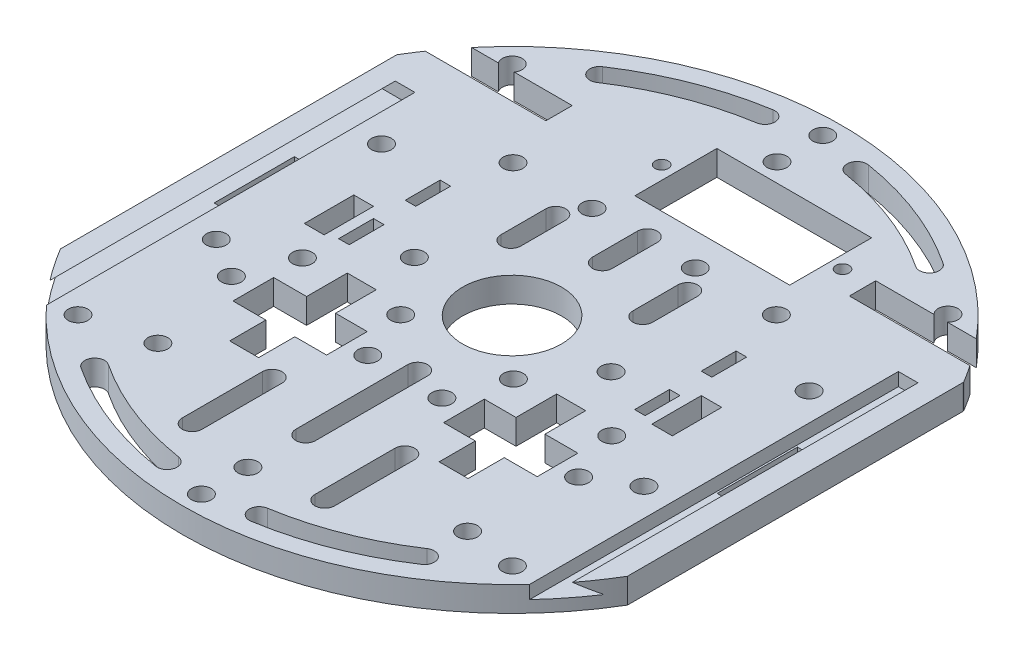
from build123d import *

# Parameters (mm, degrees)
ESQUISSE1_R             = 1.5
ESQUISSE1_W             = 1.6
ESQUISSE1_H             = 5.3
ESQUISSE1_W_2           = 2.5
ESQUISSE1_H_2           = 12.187925894
ESQUISSE1_W_3           = 3
ESQUISSE1_H_3           = 7.5
ESQUISSE1_R_2           = 1
ESQUISSE1_R_3           = 7.5
ESQUISSE1_W_4           = 3.09879963
ESQUISSE1_W_5           = 2.408451493
ESQUISSE1_W_6           = 23.501125708
ESQUISSE1_H_4           = 12.442637558
BOSS_EXTRU_1_DEPTH      = 3.8
ESQUISSE2_W             = 18.3
ESQUISSE2_H             = 4
ENL_V_MAT_EXTRU_1_DEPTH = 10
ENL_V_START             = -6.21
ENL_V_MAT_EXTRU_3_DEPTH = 65.74


with BuildPart() as part:
    # Esquisse1 → Boss.-Extru.1 (new body)
    with BuildSketch(Plane(origin=(0, 0, 0), x_dir=(1, 0, 0), z_dir=(0, 1, 0))):
        with BuildLine():
            Line((35.834434648, 167.520022271), (35.834434648, 116.483137771))
            ThreePointArc((35.834434648, 116.483137771), (78.874434648, 91.965268258), (121.914434648, 116.483137771))
            Line((121.914434648, 116.483137771), (121.914434648, 116.551281317))
            Line((121.914434648, 116.551281317), (121.914434648, 167.451878725))
            ThreePointArc((121.914434648, 167.451878725), (121.905555919, 167.517672727), (121.879554918, 167.578759801))
            ThreePointArc((121.879554918, 167.578759801), (78.840278049, 192.037880126), (35.834434648, 167.520022271))
        make_face()
        with Locations(Location((45.826639299, 109.150380711, 0), (0, 0, 90))):
            Circle(ESQUISSE1_R, mode=Mode.SUBTRACT)
        with Locations(Location((55.638558291, 111.468388624, 0), (0, 0, 90))):
            Circle(ESQUISSE1_R, mode=Mode.SUBTRACT)
        with BuildLine():
            ThreePointArc((71.647029759, 95.137737644), (61.941305066, 97.781552096), (53.012507585, 102.414847058))
            ThreePointArc((53.012507585, 102.414847058), (52.590292227, 104.493725167), (54.669170336, 104.915940525))
            ThreePointArc((54.669170336, 104.915940525), (63.032596319, 100.576025821), (72.123754479, 98.099617713))
            ThreePointArc((72.123754479, 98.099617713), (73.366332154, 96.380315319), (71.647029759, 95.137737644))
        make_face(mode=Mode.SUBTRACT)
        with Locations(Location((78.779387596, 94.934167737, 0), (0, 0, 90))):
            Circle(ESQUISSE1_R, mode=Mode.SUBTRACT)
        with Locations(Location((78.779387596, 101.991662508, 0), (0, 0, 90))):
            Circle(ESQUISSE1_R, mode=Mode.SUBTRACT)
        with BuildLine():
            ThreePointArc((67.298661598, 115.661128867), (68.798661598, 117.161128867), (70.298661598, 115.661128867))
            Line((70.298661598, 115.661128867), (70.298661598, 103.507050761))
            ThreePointArc((70.298661598, 103.507050761), (68.798661598, 102.007050761), (67.298661598, 103.507050761))
            Line((67.298661598, 103.507050761), (67.298661598, 115.661128867))
        make_face(mode=Mode.SUBTRACT)
        with Locations(Location((52.421601233, 125.843457604, 0), (0, 0, 90))):
            Circle(ESQUISSE1_R, mode=Mode.SUBTRACT)
        with Locations(Location((46.409268342, 129.560473998, 0), (0, 0, 90))):
            Circle(ESQUISSE1_R, mode=Mode.SUBTRACT)
        with Locations(Location((55.393988642, 133.652108861, 0), (0, 0, 90))):
            Circle(ESQUISSE1_R, mode=Mode.SUBTRACT)
        with Locations((56.403512098, 141.588703433)):
            Rectangle(ESQUISSE1_W, ESQUISSE1_H, mode=Mode.SUBTRACT)
        Polygon((55.777306889, 122.723571348), (55.777306889, 128.903170923), (60.777306889, 128.903170923), (60.777306889, 135.08096829), (65.174368531, 135.08096829), (65.174368531, 128.903170923), (69.992497573, 128.903170923), (69.992497573, 122.723571348), (65.174368531, 122.723571348), (65.174368531, 117.226495279), (60.777306889, 117.226495279), (60.777306889, 122.723571348), align=None, mode=Mode.SUBTRACT)
        with Locations(Location((73.158157676, 125.813371136, 0), (0, 0, 90))):
            Circle(ESQUISSE1_R, mode=Mode.SUBTRACT)
        with Locations(Location((70.317992081, 133.652108861, 0), (0, 0, 90))):
            Circle(ESQUISSE1_R, mode=Mode.SUBTRACT)
        with BuildLine():
            ThreePointArc((103.079698961, 104.915940525), (105.158577069, 104.493725167), (104.736361712, 102.414847058))
            ThreePointArc((104.736361712, 102.414847058), (95.80756423, 97.781552096), (86.101839537, 95.137737644))
            ThreePointArc((86.101839537, 95.137737644), (84.382537143, 96.380315319), (85.625114817, 98.099617713))
            ThreePointArc((85.625114817, 98.099617713), (94.716272977, 100.576025821), (103.079698961, 104.915940525))
        make_face(mode=Mode.SUBTRACT)
        with BuildLine():
            Line((87.432291643, 103.507050761), (87.432291643, 115.661128867))
            ThreePointArc((87.432291643, 115.661128867), (88.932291643, 117.161128867), (90.432291643, 115.661128867))
            Line((90.432291643, 115.661128867), (90.432291643, 103.507050761))
            ThreePointArc((90.432291643, 103.507050761), (88.932291643, 102.007050761), (87.432291643, 103.507050761))
        make_face(mode=Mode.SUBTRACT)
        with Locations(Location((103.866070776, 110.258751266, 0), (0, 0, 90))):
            Circle(ESQUISSE1_R, mode=Mode.SUBTRACT)
        with Locations(Location((111.829584697, 109.103509138, 0), (0, 0, 90))):
            Circle(ESQUISSE1_R, mode=Mode.SUBTRACT)
        with BuildLine():
            ThreePointArc((77.407537365, 127.639089221), (78.907537365, 129.139089221), (80.407537365, 127.639089221))
            Line((80.407537365, 127.639089221), (80.407537365, 110.639089221))
            ThreePointArc((80.407537365, 110.639089221), (78.907537365, 109.139089221), (77.407537365, 110.639089221))
            Line((77.407537365, 110.639089221), (77.407537365, 127.639089221))
        make_face(mode=Mode.SUBTRACT)
        with Locations(Location((84.410371198, 125.813371136, 0), (0, 0, 90))):
            Circle(ESQUISSE1_R, mode=Mode.SUBTRACT)
        Polygon((92.574500765, 135.08096829), (96.971562407, 135.08096829), (96.971562407, 128.903170923), (101.971562407, 128.903170923), (101.971562407, 122.723571348), (96.971562407, 122.723571348), (96.971562407, 117.226495279), (92.574500765, 117.226495279), (92.574500765, 122.723571348), (87.756371724, 122.723571348), (87.756371724, 128.903170923), (92.574500765, 128.903170923), align=None, mode=Mode.SUBTRACT)
        with Locations(Location((87.32715946, 133.757209253, 0), (0, 0, 90))):
            Circle(ESQUISSE1_R, mode=Mode.SUBTRACT)
        with Locations(Location((105.167621672, 125.813371136, 0), (0, 0, 90))):
            Circle(ESQUISSE1_R, mode=Mode.SUBTRACT)
        with Locations(Location((102.25609839, 133.757209253, 0), (0, 0, 90))):
            Circle(ESQUISSE1_R, mode=Mode.SUBTRACT)
        Polygon((102.145357199, 138.938703433), (100.545408567, 138.938687926), (100.545357199, 144.238687926), (102.145357199, 144.238703433), align=None, mode=Mode.SUBTRACT)
        with Locations(Location((111.339600955, 129.560473998, 0), (0, 0, 90))):
            Circle(ESQUISSE1_R, mode=Mode.SUBTRACT)
        with Locations((40.707988868, 142.276611974)):
            Rectangle(ESQUISSE1_W_2, ESQUISSE1_H_2, mode=Mode.SUBTRACT)
        with Locations((52.502940431, 142.090510183)):
            Rectangle(ESQUISSE1_W_3, ESQUISSE1_H_3, mode=Mode.SUBTRACT)
        with Locations((56.403512098, 151.701300531)):
            Rectangle(ESQUISSE1_W, ESQUISSE1_H, mode=Mode.SUBTRACT)
        with Locations(Location((46.409268342, 154.641573871, 0), (0, 0, 90))):
            Circle(ESQUISSE1_R, mode=Mode.SUBTRACT)
        with Locations(Location((63.821984803, 142.221597832, 0), (0, 0, 90))):
            Circle(ESQUISSE1_R, mode=Mode.SUBTRACT)
        with Locations(Location((58.859299527, 162.163285155, 0), (0, 0, 90))):
            Circle(ESQUISSE1_R, mode=Mode.SUBTRACT)
        with BuildLine():
            ThreePointArc((67.405550143, 158.615345539), (68.905550143, 160.115345539), (70.405550143, 158.615345539))
            Line((70.405550143, 158.615345539), (70.405550143, 151.80054615))
            ThreePointArc((70.405550143, 151.80054615), (68.905550143, 150.30054615), (67.405550143, 151.80054615))
            Line((67.405550143, 151.80054615), (67.405550143, 158.615345539))
        make_face(mode=Mode.SUBTRACT)
        with BuildLine():
            ThreePointArc((77.294154599, 162.614914575), (78.794154599, 164.114914575), (80.294154599, 162.614914575))
            Line((80.294154599, 162.614914575), (80.294154599, 155.800115186))
            ThreePointArc((80.294154599, 155.800115186), (78.794154599, 154.300115186), (77.294154599, 155.800115186))
            Line((77.294154599, 155.800115186), (77.294154599, 162.614914575))
        make_face(mode=Mode.SUBTRACT)
        with Locations(Location((70.864412562, 162.163285155, 0), (0, 0, 90))):
            Circle(ESQUISSE1_R, mode=Mode.SUBTRACT)
        with Locations(Location((45.826639299, 175.080590631, 0), (0, 0, 90))):
            Circle(ESQUISSE1_R, mode=Mode.SUBTRACT)
        with Locations(Location((70.405550143, 173.185321498, 0), (0, 0, 90))):
            Circle(ESQUISSE1_R_2, mode=Mode.SUBTRACT)
        with BuildLine():
            ThreePointArc((54.669170336, 179.087219517), (52.590292227, 179.509434875), (53.012507585, 181.588312984))
            ThreePointArc((53.012507585, 181.588312984), (61.941305066, 186.221607946), (71.647029759, 188.865422397))
            ThreePointArc((71.647029759, 188.865422397), (73.366332154, 187.622844723), (72.123754479, 185.903542329))
            ThreePointArc((72.123754479, 185.903542329), (63.032596319, 183.427134221), (54.669170336, 179.087219517))
        make_face(mode=Mode.SUBTRACT)
        with Locations(Location((78.779387596, 182.324270154, 0), (0, 0, 90))):
            Circle(ESQUISSE1_R, mode=Mode.SUBTRACT)
        with Locations(Location((78.779387596, 189.265840996, 0), (0, 0, 90))):
            Circle(ESQUISSE1_R, mode=Mode.SUBTRACT)
        with Locations(Location((78.874434648, 142.001580021, 0), (0, 0, 90))):
            Circle(ESQUISSE1_R_3, mode=Mode.SUBTRACT)
        with Locations(Location((93.783075314, 142.123577455, 0), (0, 0, 90))):
            Circle(ESQUISSE1_R, mode=Mode.SUBTRACT)
        with BuildLine():
            Line((87.432291643, 151.80054615), (87.432291643, 158.615345539))
            ThreePointArc((87.432291643, 158.615345539), (88.932291643, 160.115345539), (90.432291643, 158.615345539))
            Line((90.432291643, 158.615345539), (90.432291643, 151.80054615))
            ThreePointArc((90.432291643, 151.80054615), (88.932291643, 150.30054615), (87.432291643, 151.80054615))
        make_face(mode=Mode.SUBTRACT)
        with Locations(Location((86.533099498, 162.163285155, 0), (0, 0, 90))):
            Circle(ESQUISSE1_R, mode=Mode.SUBTRACT)
        with Locations(Location((98.837943517, 162.163285155, 0), (0, 0, 90))):
            Circle(ESQUISSE1_R, mode=Mode.SUBTRACT)
        with Locations((105.316670961, 142.090510183)):
            Rectangle(ESQUISSE1_W_4, ESQUISSE1_H_3, mode=Mode.SUBTRACT)
        Polygon((102.145357199, 149.055077174), (100.545310556, 149.05129834), (100.545259188, 154.351313005), (102.145357199, 154.355091961), align=None, mode=Mode.SUBTRACT)
        with Locations((117.040821997, 142.276611974)):
            Rectangle(ESQUISSE1_W_5, ESQUISSE1_H_2, mode=Mode.SUBTRACT)
        with Locations(Location((111.339600955, 154.641573871, 0), (0, 0, 90))):
            Circle(ESQUISSE1_R, mode=Mode.SUBTRACT)
        with Locations((84.201914375, 173.296740459)):
            Rectangle(ESQUISSE1_W_6, ESQUISSE1_H_4, mode=Mode.SUBTRACT)
        with Locations(Location((97.864345109, 173.185321498, 0), (0, 0, 90))):
            Circle(ESQUISSE1_R_2, mode=Mode.SUBTRACT)
        with BuildLine():
            ThreePointArc((86.101839537, 188.865422397), (95.80756423, 186.221607946), (104.736361712, 181.588312984))
            ThreePointArc((104.736361712, 181.588312984), (105.158577069, 179.509434875), (103.079698961, 179.087219517))
            ThreePointArc((103.079698961, 179.087219517), (94.716272977, 183.427134221), (85.625114817, 185.903542329))
            ThreePointArc((85.625114817, 185.903542329), (84.382537143, 187.622844723), (86.101839537, 188.865422397))
        make_face(mode=Mode.SUBTRACT)
        with Locations(Location((111.789066553, 175.276830964, 0), (0, 0, 90))):
            Circle(ESQUISSE1_R, mode=Mode.SUBTRACT)
    extrude(amount=BOSS_EXTRU_1_DEPTH)

    # Esquisse2 → Enlèv. mat.-Extru.1 (cut)
    with BuildSketch(Plane(origin=(0, 0, 0), x_dir=(-1, 0, 0), z_dir=(0, -1, 0))):
        with Locations((-111.064434648, 172.178759801)):
            Rectangle(ESQUISSE2_W, ESQUISSE2_H)
        with Locations((-46.684434648, 172.178759801)):
            Rectangle(ESQUISSE2_W, ESQUISSE2_H)
    extrude(amount=-ENL_V_MAT_EXTRU_1_DEPTH, mode=Mode.SUBTRACT)

    # Esquisse3 → Enlèv. mat.-Extru.3 (cut)
    with BuildSketch(Plane(origin=(0, 0, -170.178759801), x_dir=(-1, 0, 0), z_dir=(0, 0, -1)).offset(ENL_V_START)):
        Polygon((-39.375146155, 4), (-42.157988868, 4), (-42.157988868, 1.8), (-37.175146155, 1.8), align=None)
        Polygon((-120.538843411, 1.8), (-118.338843411, 4), (-115.556000698, 4), (-115.556000698, 1.8), align=None)
    extrude(amount=-ENL_V_MAT_EXTRU_3_DEPTH, mode=Mode.SUBTRACT)


solid = part.part
